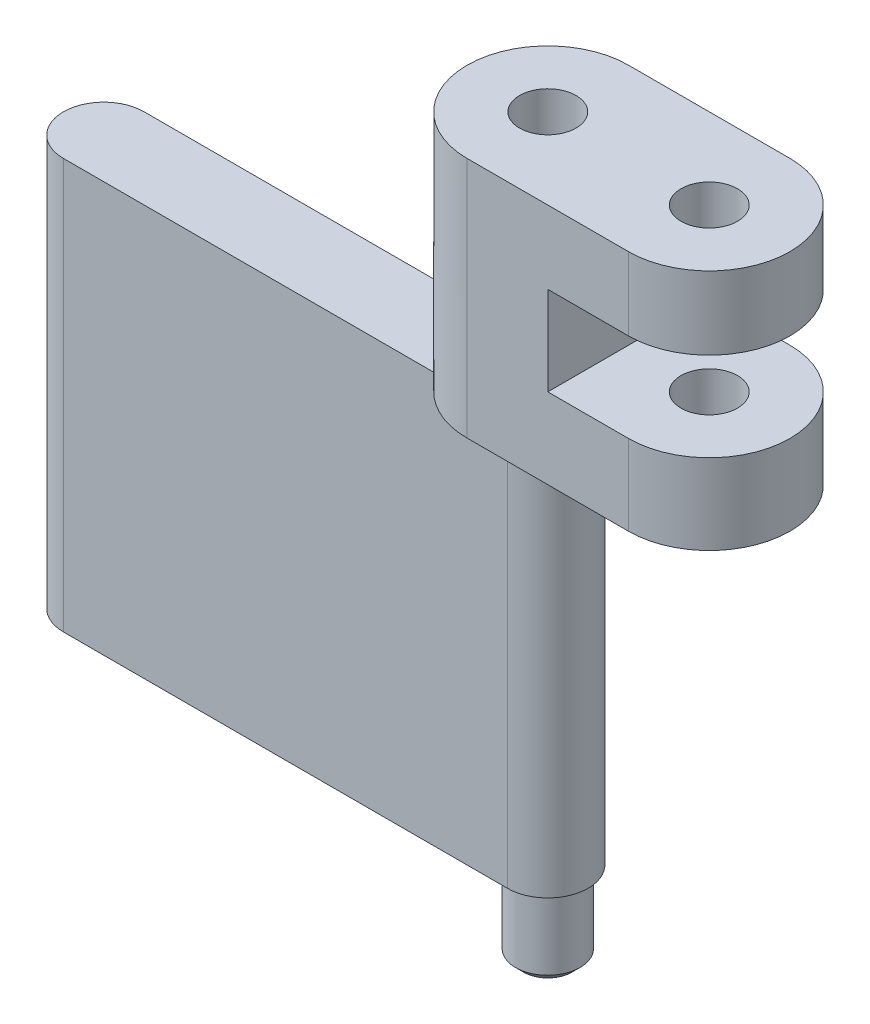
from build123d import *

# Parameters (mm, degrees)
SKETCH1_R           = 3.5
BOSS_EXTRUDE1_DEPTH = 30
BOSS_EXTRUDE2_DEPTH = 50.8
SKETCH3_R           = 4
BOSS_EXTRUDE3_DEPTH = 10
CHAMFER1_SIZE       = 1
SKETCH4_W           = 30
SKETCH4_H           = 11
CUT_EXTRUDE1_DEPTH  = 95.850619397


with BuildPart() as part:
    # Sketch1 → Boss-Extrude1 (new body)
    with BuildSketch(Plane(origin=(0, 0, 0), x_dir=(1, 0, 0), z_dir=(0, 1, 0))):
        with BuildLine():
            Line((-10, 10), (10, 10))
            ThreePointArc((10, 10), (20, 0), (10, -10))
            Line((10, -10), (-10, -10))
            ThreePointArc((-10, -10), (-20, 0), (-10, 10))
        make_face()
        with Locations(Location((-10, 0, 0), (0, 0, 270))):
            Circle(SKETCH1_R, mode=Mode.SUBTRACT)
        with Locations(Location((10, 0, 0), (0, 0, 270))):
            Circle(SKETCH1_R, mode=Mode.SUBTRACT)
    extrude(amount=BOSS_EXTRUDE1_DEPTH)

    # Sketch2 → Boss-Extrude2 (add)
    with BuildSketch(Plane.XZ):
        with BuildLine():
            Line((-10, -5), (-65, -5))
            ThreePointArc((-65, -5), (-70, 0), (-65, 5))
            Line((-65, 5), (-10, 5))
            ThreePointArc((-10, 5), (-5, 0), (-10, -5))
        make_face()
    extrude(amount=BOSS_EXTRUDE2_DEPTH)

    # Sketch3 → Boss-Extrude3 (add)
    with BuildSketch(Plane.XZ.offset(50.8)):
        with Locations(Location((-10, 0, 0), (0, 0, 270))):
            Circle(SKETCH3_R)
    extrude(amount=BOSS_EXTRUDE3_DEPTH)

    # Chamfer1
    chamfer1_edges = [part.edges().sort_by_distance(p)[0] for p in [
        (-10, -60.8, 4),
    ]]
    chamfer(chamfer1_edges, length=CHAMFER1_SIZE)

    # Sketch4 → Cut-Extrude1 (cut, through all)
    with BuildSketch(Plane(origin=(0, 0, -10), x_dir=(-1, 0, 0), z_dir=(0, 0, -1))):
        with Locations((-15, 15.456720209)):
            Rectangle(SKETCH4_W, SKETCH4_H)
    extrude(amount=-CUT_EXTRUDE1_DEPTH, mode=Mode.SUBTRACT)


solid = part.part
